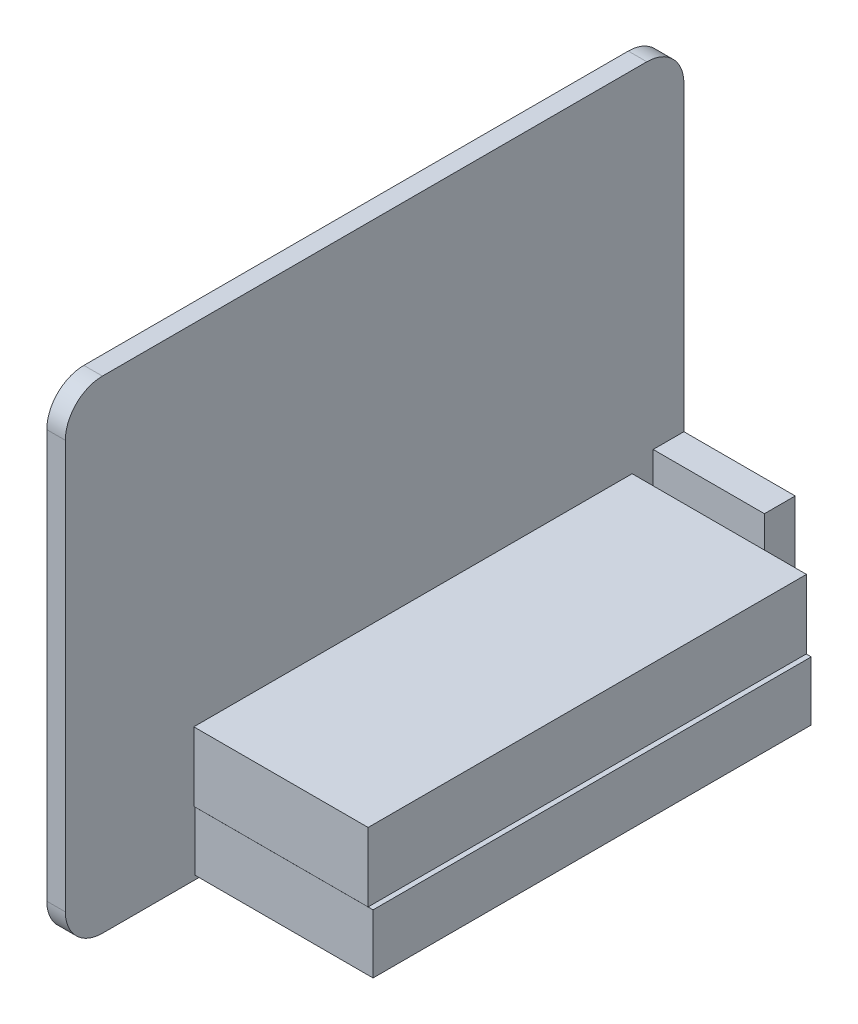
from build123d import *

# Parameters (mm, degrees)
BOSS_EXTRUDE1_DEPTH = 5
SKETCH2_W           = 118.181462396
SKETCH2_H           = 18.559001235
BOSS_EXTRUDE4_DEPTH = 47
SKETCH3_W           = 118.126380902
SKETCH3_H           = 15.915848605
BOSS_EXTRUDE5_DEPTH = 48
SKETCH4_W           = 8.296758782
SKETCH4_H           = 26.299414598
BOSS_EXTRUDE6_DEPTH = 30
CUT_EXTRUDE3_DEPTH  = 7
SKETCH6_W           = 2.21745904
SKETCH6_H           = 1.840019648
SKETCH6_W_2         = 2.568509623
SKETCH6_W_3         = 2.623522206
SKETCH6_H_2         = 1.802097087
BOSS_EXTRUDE7_DEPTH = 7


with BuildPart() as part:
    # Sketch1 → Boss-Extrude1 (new body)
    with BuildSketch(Plane(origin=(0, 0, 0), x_dir=(0, 0, -1), z_dir=(1, 0, 0))):
        with BuildLine():
            Line((-15.48154183, 15.615913897), (131.29221645, 15.615913897))
            ThreePointArc((131.29221645, 15.615913897), (138.363284262, 12.686981708), (141.29221645, 5.615913897))
            Line((141.29221645, 5.615913897), (141.29221645, -104.488481637))
            ThreePointArc((141.29221645, -104.488481637), (138.363284262, -111.559549449), (131.29221645, -114.488481637))
            Line((131.29221645, -114.488481637), (-15.48154183, -114.488481637))
            ThreePointArc((-15.48154183, -114.488481637), (-22.552609641, -111.559549449), (-25.48154183, -104.488481637))
            Line((-25.48154183, -104.488481637), (-25.48154183, 5.615913897))
            ThreePointArc((-25.48154183, 5.615913897), (-22.552609641, 12.686981708), (-15.48154183, 15.615913897))
        make_face()
    extrude(amount=BOSS_EXTRUDE1_DEPTH)

    # Sketch2 → Boss-Extrude4 (add)
    with BuildSketch(Plane(origin=(5, 0, 0), x_dir=(0, 0, -1), z_dir=(1, 0, 0))):
        with Locations((68.242208416, -87.869944527)):
            Rectangle(SKETCH2_W, SKETCH2_H)
    extrude(amount=BOSS_EXTRUDE4_DEPTH)

    # Sketch3 → Boss-Extrude5 (add)
    with BuildSketch(Plane(origin=(5, 0, 0), x_dir=(0, 0, -1), z_dir=(1, 0, 0))):
        with Locations((68.5485811, -105.450077262)):
            Rectangle(SKETCH3_W, SKETCH3_H)
    extrude(amount=BOSS_EXTRUDE5_DEPTH)

    # Sketch4 → Boss-Extrude6 (add)
    with BuildSketch(Plane(origin=(5, 0, 0), x_dir=(0, 0, -1), z_dir=(1, 0, 0))):
        with Locations((137.143837059, -88.907539255)):
            Rectangle(SKETCH4_W, SKETCH4_H)
    extrude(amount=BOSS_EXTRUDE6_DEPTH)

    # Sketch5 → Cut-Extrude3 (cut)
    with BuildSketch(Plane(origin=(0, 0, -141.29221645), x_dir=(-1, 0, 0), z_dir=(0, 0, -1))):
        Polygon((-25.464332728, -97.926181685), (-12.810425415, -97.926181685), (-8.73119877, -90.234247578), (-8.73119877, -80.275506322), (-31.116096198, -80.275506322), (-31.116096198, -91.525760494), align=None)
    extrude(amount=-CUT_EXTRUDE3_DEPTH, mode=Mode.SUBTRACT)

    # Sketch6 → Boss-Extrude7 (add)
    with BuildSketch(Plane(origin=(0, 0, -134.29221645), x_dir=(-1, 0, 0), z_dir=(0, 0, -1))):
        with Locations((-25.041507493, -87.601540864)):
            Rectangle(SKETCH6_W, SKETCH6_H)
        with Locations((-13.458219738, -87.601540864)):
            Rectangle(SKETCH6_W_2, SKETCH6_H)
        with Locations((-19.506551217, -92.8677498)):
            Rectangle(SKETCH6_W_3, SKETCH6_H_2)
    extrude(amount=BOSS_EXTRUDE7_DEPTH)


solid = part.part
